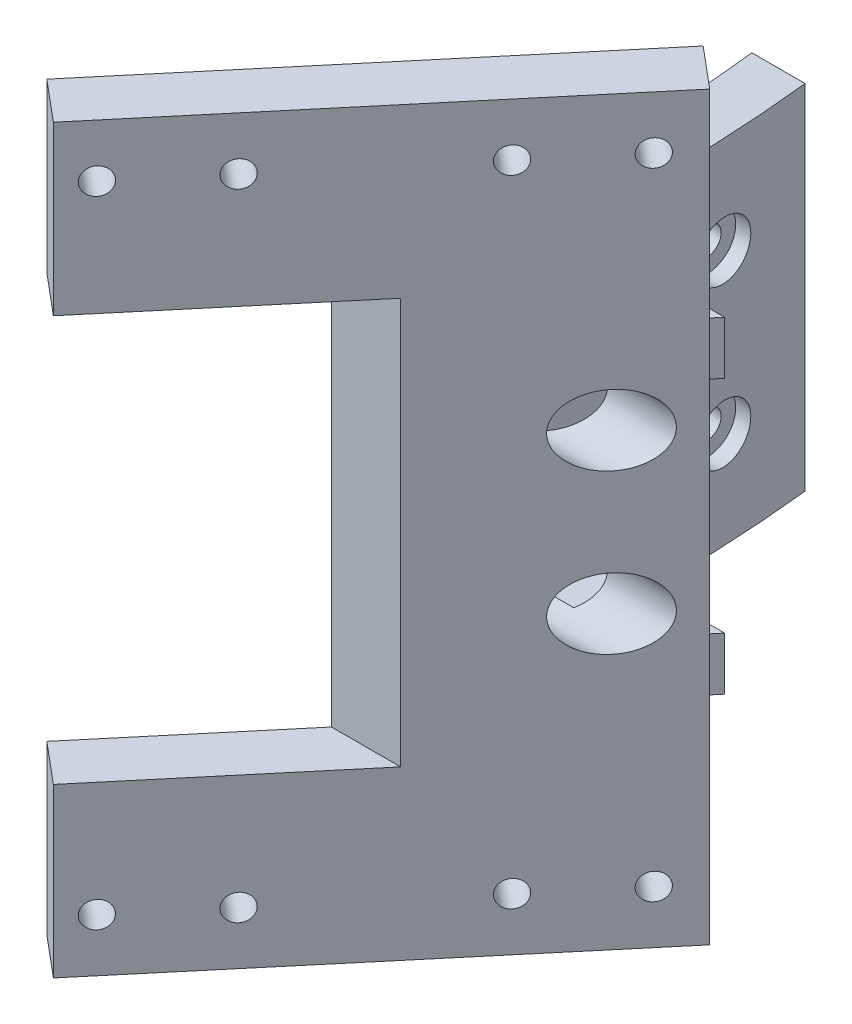
from build123d import *

# Parameters (mm, degrees)
SKETCH_1_W          = 52.8
SKETCH_1_H          = 84
EXTRUDE_1_DEPTH     = 6
SKETCH_2_R          = 1.5
CUT_EXTRUDE_1_DEPTH = 8
SKETCH_3_W          = 60
SKETCH_3_H          = 46
CUT_EXTRUDE_2_DEPTH = 50
EXTRUDE_2_DEPTH     = 40
EXTRUDE_3_DEPTH     = 6
EXTRUDE_4_DEPTH     = 6
SKETCH_7_R          = 1.6
CUT_EXTRUDE_3_DEPTH = 70
SKETCH_8_R          = 3.25
CUT_EXTRUDE_4_DEPTH = 12
SKETCH_9_R          = 4
CUT_EXTRUDE_5_DEPTH = 23.5


with BuildPart() as part:
    # 草图1 → 凸台-拉伸1 (new body)
    with BuildSketch(Plane(origin=(159.175409567, 0, 133.564027461), x_dir=(0.6427876096867067, 0, -0.7660444431188377), z_dir=(0.7660444431188378, 0, 0.6427876096867067))):
        with Locations((140.187338197, 0)):
            Rectangle(SKETCH_1_W, SKETCH_1_H)
    extrude(amount=-EXTRUDE_1_DEPTH)

    # 草图2 → 切除-拉伸1 (cut)
    with BuildSketch(Plane(origin=(159.175409567, 0, 133.564027461), x_dir=(0.6427876096867067, 0, -0.7660444431188377), z_dir=(0.7660444431188378, 0, 0.6427876096867067))):
        with Locations((117.287338197, -36)):
            Circle(SKETCH_2_R)
        with Locations((117.287338197, 36)):
            Circle(SKETCH_2_R)
        with Locations((150.687338197, 36)):
            Circle(SKETCH_2_R)
        with Locations((128.687338197, 36)):
            Circle(SKETCH_2_R)
        with Locations((128.687338197, -36)):
            Circle(SKETCH_2_R)
        with Locations((162.087338197, 36)):
            Circle(SKETCH_2_R)
        with Locations((162.087338197, -36)):
            Circle(SKETCH_2_R)
        with Locations((150.687338197, -36)):
            Circle(SKETCH_2_R)
    extrude(amount=-CUT_EXTRUDE_1_DEPTH, mode=Mode.SUBTRACT)

    # 草图3 → 切除-拉伸2 (cut)
    with BuildSketch(Plane.XY.offset(25)):
        with Locations((250, 0)):
            Rectangle(SKETCH_3_W, SKETCH_3_H)
    extrude(amount=CUT_EXTRUDE_2_DEPTH, mode=Mode.SUBTRACT)

    # 草图4 → 凸台-拉伸2 (add)
    with BuildSketch(Plane(origin=(0, 20, 0), x_dir=(-1, 0, 0), z_dir=(0, -1, 0))):
        with BuildLine():
            Line((-249.1237949, 22), (-243.086632908, 22))
            add(Edge.make_bspline(
                [(-243.086632908, 22), (-243.481254737, 18.531426174), (-243.784948463, 14.933770973), (-243.993041019, 11.223078881), (-244.1, 7.416444076), (-244.1, 3.53121788)],
                knots=[0.778865295, 0.778865295, 0.778865295, 0.778865295, 0.778865295, 0.778865295, 1, 1, 1, 1, 1, 1], degree=5))
            add(Edge.make_bspline(
                [(-244.1, 3.53121788), (-244.1, -1.069863619), (-243.955995612, -5.56513348), (-243.676385618, -9.929661799), (-243.268946043, -14.139045721), (-242.741071446, -18.169549128), (-242.097814731, -22)],
                knots=[0, 0, 0, 0, 0, 0, 0, 0.314254692, 0.314254692, 0.314254692, 0.314254692, 0.314254692, 0.314254692, 0.314254692], degree=6))
            Line((-242.097814731, -22), (-248.177885229, -22))
            add(Edge.make_bspline(
                [(-248.177885229, -22), (-248.800145217, -18.111595668), (-249.307087627, -14.054845034), (-249.696626763, -9.84368942), (-249.96306742, -5.496084567), (-250.1, -1.031127344), (-250.1, 3.53121788)],
                knots=[0.698640687, 0.698640687, 0.698640687, 0.698640687, 0.698640687, 0.698640687, 0.698640687, 1, 1, 1, 1, 1, 1, 1], degree=6))
            add(Edge.make_bspline(
                [(-250.1, 3.53121788), (-250.1, 7.398092065), (-249.997534101, 11.192091342), (-249.797793696, 14.899179655), (-249.505456591, 18.505771646), (-249.1237949, 22)],
                knots=[0, 0, 0, 0, 0, 0, 0.212850791, 0.212850791, 0.212850791, 0.212850791, 0.212850791, 0.212850791], degree=5))
        make_face()
    extrude(amount=EXTRUDE_2_DEPTH)

    # 草图5 → 凸台-拉伸3 (add)
    with BuildSketch(Plane(origin=(0, -18.5, 0), x_dir=(-1, 0, 0), z_dir=(0, -1, 0))):
        Polygon((-246, -4), (-266, -4), (-250, -23), (-244, -23), align=None)
    extrude(amount=-EXTRUDE_3_DEPTH)

    # 草图6 → 凸台-拉伸4 (add)
    with BuildSketch(Plane(origin=(0, 12.5, 0), x_dir=(-1, 0, 0), z_dir=(0, -1, 0))):
        Polygon((-246, -4), (-266, -4), (-250, -23), (-244, -23), align=None)
    extrude(amount=-EXTRUDE_4_DEPTH)

    # 草图7 → 切除-拉伸3 (cut)
    with BuildSketch(Plane(origin=(285, 0, 0), x_dir=(0, 0, -1), z_dir=(1, 0, 0))):
        with Locations((12, -9)):
            Circle(SKETCH_7_R)
        with Locations((-12, -9)):
            Circle(SKETCH_7_R)
        with Locations((12, 9)):
            Circle(SKETCH_7_R)
        with Locations((-12, 9)):
            Circle(SKETCH_7_R)
    extrude(amount=-CUT_EXTRUDE_3_DEPTH, mode=Mode.SUBTRACT)

    # 草图8 → 切除-拉伸4 (cut)
    with BuildSketch(Plane(origin=(260, 0, 0), x_dir=(0, 0, -1), z_dir=(1, 0, 0))):
        with Locations((12, -9)):
            Circle(SKETCH_8_R)
        with Locations((-12, -9)):
            Circle(SKETCH_8_R)
        with Locations((12, 9)):
            Circle(SKETCH_8_R)
        with Locations((-12, 9)):
            Circle(SKETCH_8_R)
    extrude(amount=-CUT_EXTRUDE_4_DEPTH, mode=Mode.SUBTRACT)

    # 草图9 → 切除-拉伸5 (cut)
    with BuildSketch(Plane(origin=(275, 0, 0), x_dir=(0, 0, -1), z_dir=(1, 0, 0))):
        with Locations((-12, -9)):
            Circle(SKETCH_9_R)
        with Locations((-12, 9)):
            Circle(SKETCH_9_R)
    extrude(amount=-CUT_EXTRUDE_5_DEPTH, mode=Mode.SUBTRACT)


solid = part.part
